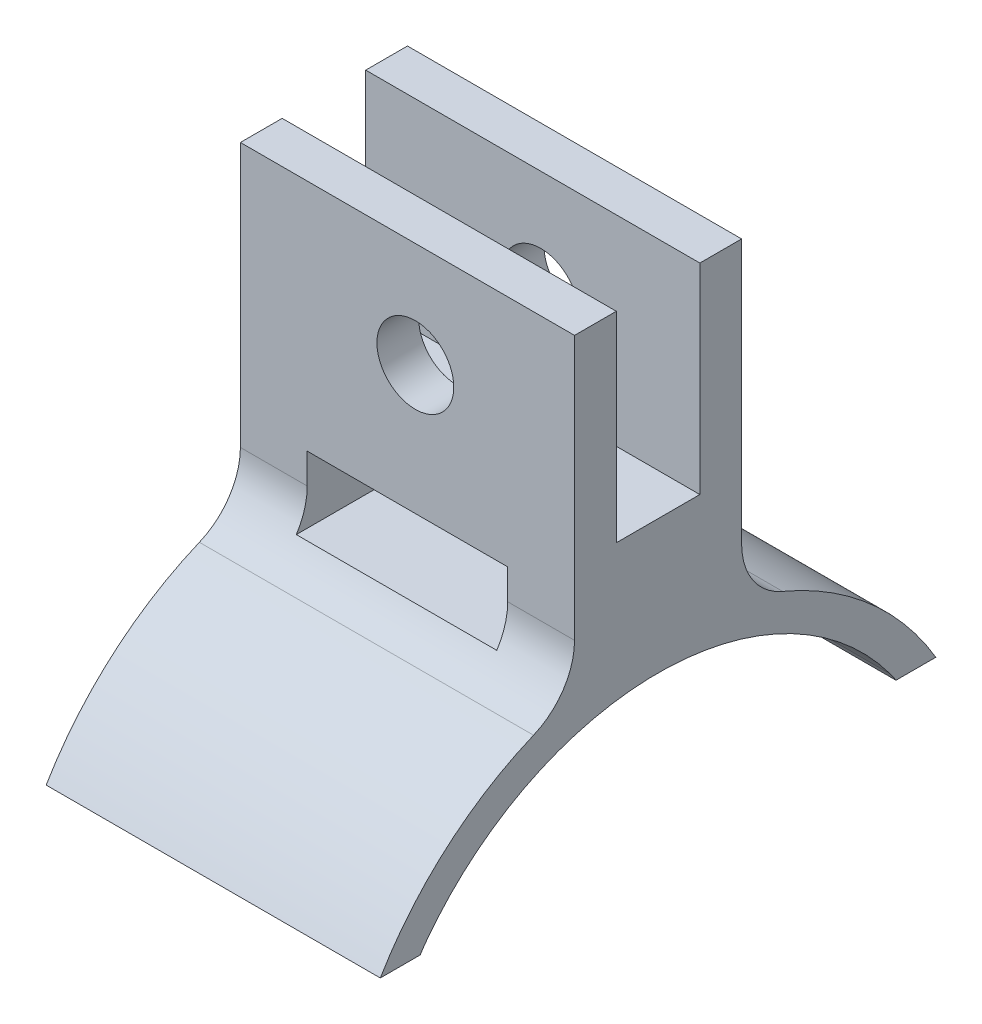
from build123d import *

# Parameters (mm, degrees)
SKETCH1_R                            = 12.2555
SKETCH1_R_2                          = 10.9855
BOSS_EXTRUDE1_DEPTH                  = 25.4
CUT_EXTRUDE1_DEPTH                   = 31.749870902
CUT_EXTRUDE1_DEPTH_BACK              = 31.749870902
SKETCH2_W                            = 7.874
SKETCH2_H                            = 0.935
SKETCH8_W                            = 25.4
SKETCH8_H                            = 6.35
BOSS_EXTRUDE2_DEPTH                  = 11.43
BOSS_EXTRUDE2_DIRECTION_2_REACH      = 39.365
BOSS_EXTRUDE2_DIRECTION_2_END_RADIUS = 12.2555
SKETCH9_R                            = 1.4605
CUT_EXTRUDE6_DEPTH                   = 39.003463533
SKETCH10_W                           = 3.175
SKETCH10_H                           = 7.62
CUT_EXTRUDE7_DEPTH                   = 25.4
FILLET2_R                            = 2.54
SKETCH11_R                           = 10.9855
CUT_EXTRUDE8_DEPTH                   = 37.82879567
SKETCH12_R                           = 1.2875
BOSS_EXTRUDE3_DEPTH                  = 2.196999908
BOSS_EXTRUDE4_START                  = -25.4
BOSS_EXTRUDE4_DEPTH                  = 25.4
FILLET3_R                            = 5.08
FILLET3_OF_MIRROR2_R                 = 5.08
CUT_EXTRUDE9_DEPTH                   = 43.697648058
CUT_EXTRUDE9_DEPTH_BACK              = 43.697648058
SKETCH13_W                           = 17.526
SKETCH13_H                           = 2.120056883
SKETCH13_W_2                         = 0.599999908
SKETCH13_H_2                         = 18.990443025
FILLET4_R                            = 5.08
CUT_EXTRUDE10_DEPTH                  = 37.861439453
CUT_EXTRUDE10_DEPTH_BACK             = 37.861439453
SKETCH17_W                           = 24.800000092
SKETCH17_H                           = 8.799318797
CUT_EXTRUDE11_DEPTH                  = 2.54
CUT_EXTRUDE11_DEPTH_BACK             = 37.940724096
SKETCH18_W                           = 7.62
SKETCH18_H                           = 1.148317315
SKETCH18_H_2                         = 1.391682685
CUT_EXTRUDE12_DEPTH                  = 36.881723087
CUT_EXTRUDE12_DEPTH_BACK             = 36.881723087
SKETCH19_W                           = 6.050000046
SKETCH19_H                           = 17.461181295


with BuildPart() as part:
    # Sketch1 → Boss-Extrude1 (new body)
    with BuildSketch(Plane(origin=(0, 0, 0), x_dir=(0, 0, -1), z_dir=(1, 0, 0))):
        Circle(SKETCH1_R)
        Circle(SKETCH1_R_2, mode=Mode.SUBTRACT)
    extrude(amount=BOSS_EXTRUDE1_DEPTH)

    # Sketch2 → Cut-Extrude1 (cut, two sides: drawn at the far end of the back side and taken through both)
    with BuildSketch(Plane(origin=(0, 0, 0), x_dir=(1, 0, 0), z_dir=(0, 1, 0)).offset(-CUT_EXTRUDE1_DEPTH_BACK)):
        with Locations((21.463, 11.788)):
            Rectangle(SKETCH2_W, SKETCH2_H)
        with Locations((21.463, -11.788)):
            Rectangle(SKETCH2_W, SKETCH2_H)
    extrude(amount=CUT_EXTRUDE1_DEPTH + CUT_EXTRUDE1_DEPTH_BACK, mode=Mode.SUBTRACT)

    # Sketch8 → Boss-Extrude2 (add)
    with BuildSketch(Plane(origin=(0, 12.2555, 0), x_dir=(1, 0, 0), z_dir=(0, 1, 0))):
        with Locations((12.7, 0)):
            Rectangle(SKETCH8_W, SKETCH8_H)
    extrude(amount=BOSS_EXTRUDE2_DEPTH)

    # Boss-Extrude2 direction 2: up to this cylinder (the profile starts outside it)
    boss_extrude2_direction_2_end = Plane(origin=(12.7, 0, 0), z_dir=(-1, 0, 0)) * Cylinder(BOSS_EXTRUDE2_DIRECTION_2_END_RADIUS, 104.241, mode=Mode.PRIVATE)
    # Sketch8 → Boss-Extrude2 direction 2 (add, up to the surface)
    with BuildSketch(Plane(origin=(0, 12.2555, 0), x_dir=(1, 0, 0), z_dir=(0, 1, 0)), mode=Mode.PRIVATE) as boss_extrude2_direction_2_sk1:
        with Locations((12.7, 0)):
            Rectangle(SKETCH8_W, SKETCH8_H)
    boss_extrude2_direction_2_tool1 = extrude(boss_extrude2_direction_2_sk1.sketch, amount=-BOSS_EXTRUDE2_DIRECTION_2_REACH, mode=Mode.PRIVATE) - boss_extrude2_direction_2_end
    add(boss_extrude2_direction_2_tool1.solids().sort_by_distance((12.7, 12.2555, 0))[0])
    add(boss_extrude2_direction_2_tool1.solids().sort_by_distance((12.7, 12.2555, 0))[1])

    # Sketch9 → Cut-Extrude6 (cut, through all)
    with BuildSketch(Plane(origin=(0, 0, -3.175), x_dir=(-1, 0, 0), z_dir=(0, 0, -1))):
        with Locations((-12.7, 19.685)):
            Circle(SKETCH9_R)
    extrude(amount=-CUT_EXTRUDE6_DEPTH, mode=Mode.SUBTRACT)

    # Sketch10 → Cut-Extrude7 (cut)
    with BuildSketch(Plane.ZY):
        with Locations((0, 19.8755)):
            Rectangle(SKETCH10_W, SKETCH10_H)
    extrude(amount=-CUT_EXTRUDE7_DEPTH, mode=Mode.SUBTRACT)

    # Fillet2
    fillet2_edges = [part.edges().sort_by_distance(p)[0] for p in [
        (12.7, 11.837088124, 3.175),
        (12.7, 11.837088124, -3.175),
    ]]
    fillet(fillet2_edges, radius=FILLET2_R)

    # Sketch11 → Cut-Extrude8 (cut, through all)
    with BuildSketch(Plane(origin=(25.4, 0, 0), x_dir=(0, 0, -1), z_dir=(1, 0, 0))):
        with BuildLine():
            ThreePointArc((-10.9855, 0), (-10.718799827, -2.405938595), (-9.931648919, -4.695056975))
            Line((-9.931648919, -4.695056975), (9.931648919, -4.695056975))
            ThreePointArc((9.931648919, -4.695056975), (10.718799827, -2.405938595), (10.9855, 0))
            Line((10.9855, 0), (-10.9855, 0))
        make_face()
        with BuildLine():
            Line((9.931648919, -4.695056975), (-9.931648919, -4.695056975))
            ThreePointArc((-9.931648919, -4.695056975), (0, -10.9855), (9.931648919, -4.695056975))
        make_face()
        Circle(SKETCH11_R)
        with BuildLine():
            Line((-11.3205, -4.695056975), (11.3205, -4.695056975))
            ThreePointArc((11.3205, -4.695056975), (0, -12.2555), (-11.3205, -4.695056975))
        make_face()
        with BuildLine():
            Line((-11.3205, -4.695056975), (-11.3205, -12.703036631))
            Line((-11.3205, -12.703036631), (11.3205, -12.703036631))
            Line((11.3205, -12.703036631), (11.3205, -4.695056975))
            ThreePointArc((11.3205, -4.695056975), (0, -12.2555), (-11.3205, -4.695056975))
        make_face()
        with BuildLine():
            Line((-10.9855, 0), (-10.9855, -4.695056975))
            Line((-10.9855, -4.695056975), (-9.931648919, -4.695056975))
            ThreePointArc((-9.931648919, -4.695056975), (-10.718799827, -2.405938595), (-10.9855, 0))
        make_face()
        with BuildLine():
            Line((9.931648919, -4.695056975), (10.9855, -4.695056975))
            Line((10.9855, -4.695056975), (10.9855, 0))
            ThreePointArc((10.9855, 0), (10.718799827, -2.405938595), (9.931648919, -4.695056975))
        make_face()
    extrude(amount=-CUT_EXTRUDE8_DEPTH, mode=Mode.SUBTRACT)

    # Sketch12 → Boss-Extrude3 (add)
    with BuildSketch(Plane(origin=(0, 0, -11.3205), x_dir=(-1, 0, 0), z_dir=(0, 0, -1))):
        with Locations(Location((-22.225, 0, 0), (0, 0, 180))):
            Circle(SKETCH12_R)
    boss_extrude3 = extrude(amount=BOSS_EXTRUDE3_DEPTH)

    # Mirror1: Boss-Extrude3 across plane
    add(boss_extrude3.mirror(Plane.XY))

    # Sketch14 → Boss-Extrude4 (add)
    with BuildSketch(Plane(origin=(25.4, 0, 0), x_dir=(0, 0, -1), z_dir=(1, 0, 0)).offset(BOSS_EXTRUDE4_START)):
        with BuildLine():
            ThreePointArc((-9.8205, 4.923310878), (-10.690283275, 2.529635102), (-10.9855, 0))
            Line((-10.9855, 0), (-10.9855, -4.695056975))
            Line((-10.9855, -4.695056975), (-9.8205, -4.695056975))
            Line((-9.8205, -4.695056975), (-9.8205, 4.923310878))
        make_face()
    boss_extrude4 = extrude(amount=BOSS_EXTRUDE4_DEPTH)

    # Fillet3
    fillet3_edges = [part.edges().sort_by_distance(p)[0] for p in [
        (12.7, 4.923310878, 9.8205),
    ]]
    fillet(fillet3_edges, radius=FILLET3_R)

    # Mirror2: Boss-Extrude4 across plane
    add(boss_extrude4.mirror(Plane.XY))

    # Fillet3 of Mirror2
    fillet3_of_mirror2_edges = [part.edges().sort_by_distance(p)[0] for p in [
        (12.7, 4.923310878, -9.8205),
    ]]
    fillet(fillet3_of_mirror2_edges, radius=FILLET3_OF_MIRROR2_R)

    # Sketch13 → Cut-Extrude9 (cut, two sides: drawn at the far end of the back side and taken through both)
    with BuildSketch(Plane(origin=(0, 0, -11.3205), x_dir=(-1, 0, 0), z_dir=(0, 0, -1)).offset(-CUT_EXTRUDE9_DEPTH_BACK)):
        with BuildLine():
            ThreePointArc((-22.225, -2.575000092), (-24.045800027, -1.820800027), (-24.800000092, 0))
            Line((-24.800000092, 0), (-24.800000092, 4.695056975))
            Line((-24.800000092, 4.695056975), (-25.4, 4.695056975))
            Line((-25.4, 4.695056975), (-25.4, -4.695056975))
            Line((-25.4, -4.695056975), (-17.526, -4.695056975))
            Line((-17.526, -4.695056975), (-17.526, -2.575000092))
            Line((-17.526, -2.575000092), (-22.225, -2.575000092))
        make_face()
        with Locations((-8.763, -3.635028533)):
            Rectangle(SKETCH13_W, SKETCH13_H)
        with Locations((-25.100000046, 14.190278488)):
            Rectangle(SKETCH13_W_2, SKETCH13_H_2)
    extrude(amount=CUT_EXTRUDE9_DEPTH + CUT_EXTRUDE9_DEPTH_BACK, mode=Mode.SUBTRACT)

    # Fillet4
    fillet4_edges = [part.edges().sort_by_distance(p)[0] for p in [
        (24.800000092, 23.6855, -2.38125),
        (24.800000092, 23.6855, 2.38125),
        (0, 23.6855, -2.38125),
        (0, 23.6855, 2.38125),
    ]]
    fillet(fillet4_edges, radius=FILLET4_R)

    # Sketch17 → Cut-Extrude10 (cut, two sides: drawn at the far end of the back side and taken through both)
    with BuildSketch(Plane.XY.offset(-CUT_EXTRUDE10_DEPTH_BACK)):
        with Locations((12.400000046, 1.824659306)):
            Rectangle(SKETCH17_W, SKETCH17_H)
    extrude(amount=CUT_EXTRUDE10_DEPTH + CUT_EXTRUDE10_DEPTH_BACK, mode=Mode.SUBTRACT)

    # Sketch18 → Cut-Extrude11 (cut, two sides: drawn at the far end of the back side and taken through both)
    with BuildSketch(Plane(origin=(0, 0, -3.175), x_dir=(-1, 0, 0), z_dir=(0, 0, -1)).offset(-CUT_EXTRUDE11_DEPTH_BACK)):
        with Locations((-12.400000046, 14.221341343)):
            Rectangle(SKETCH18_W, SKETCH18_H)
        with Locations((-12.400000046, 12.951341343)):
            Rectangle(SKETCH18_W, SKETCH18_H_2)
    extrude(amount=CUT_EXTRUDE11_DEPTH + CUT_EXTRUDE11_DEPTH_BACK, mode=Mode.SUBTRACT)

    # Sketch19 → Cut-Extrude12 (cut, two sides: drawn at the far end of the back side and taken through both)
    with BuildSketch(Plane.XY.offset(-CUT_EXTRUDE12_DEPTH_BACK)):
        with Locations((3.025000023, 14.954909352)):
            Rectangle(SKETCH19_W, SKETCH19_H)
        with Locations((21.775000069, 14.954909352)):
            Rectangle(SKETCH19_W, SKETCH19_H)
    extrude(amount=CUT_EXTRUDE12_DEPTH + CUT_EXTRUDE12_DEPTH_BACK, mode=Mode.SUBTRACT)


solid = part.part
